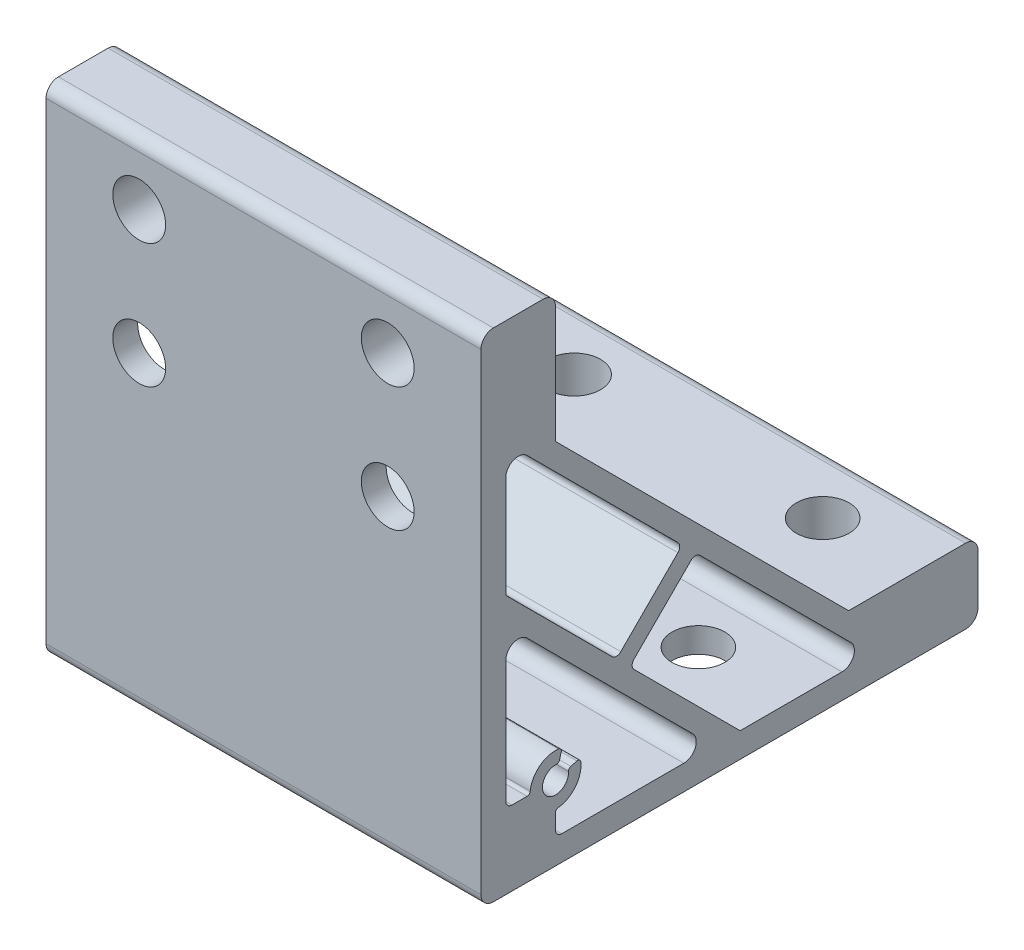
from build123d import *

# Parameters (mm, degrees)
BOSS_EXTRUDE1_DEPTH = 35
DIAMETERHOLE1_D     = 8.5
DIAMETERHOLE1_DEPTH = 12
DIAMETERHOLE2_D     = 8.5
DIAMETERHOLE2_DEPTH = 12.001
DIAMETERHOLE3_REACH = 120.427
SKETCH6_R           = 7
DIAMETERHOLE4_REACH = 120.427
SKETCH7_R           = 7
LPATTERN1_COUNT     = 2
LPATTERN1_PITCH     = 40


with BuildPart() as part:
    # Sketch1 → Boss-Extrude1 (new, symmetric)
    with BuildSketch(Plane(origin=(0, 0, 0), x_dir=(0, 0, -1), z_dir=(1, 0, 0))):
        with BuildLine():
            Line((2, 0), (78, 0))
            ThreePointArc((78, 0), (79.414213562, 0.585786438), (80, 2))
            Line((80, 2), (80, 10))
            ThreePointArc((80, 10), (79.414213562, 11.414213562), (78, 12))
            Line((78, 12), (59.176911935, 12))
            Line((59.176911935, 12), (12, 59.176911935))
            Line((12, 59.176911935), (12, 78))
            ThreePointArc((12, 78), (11.414213562, 79.414213562), (10, 80))
            Line((10, 80), (2, 80))
            ThreePointArc((2, 80), (0.585786438, 79.414213562), (0, 78))
            Line((0, 78), (0, 2))
            ThreePointArc((0, 2), (0.585786438, 0.585786438), (2, 0))
        make_face()
        with BuildLine():
            Line((7.414213562, 34.064213562), (34.064213562, 7.414213562))
            ThreePointArc((34.064213562, 7.414213562), (34.497759065, 5.234633135), (32.65, 4))
            Line((32.65, 4), (13, 4))
            ThreePointArc((13, 4), (12.292893219, 4.292893219), (12, 5))
            Line((12, 5), (12, 7.427254654))
            ThreePointArc((12, 7.427254654), (12.127727309, 7.761040579), (12.445652174, 7.924292192))
            ThreePointArc((12.445652174, 7.924292192), (15.214400117, 9.454880771), (16.069295651, 12.500832214))
            ThreePointArc((16.069295651, 12.500832214), (15.852577049, 12.854314019), (15.443630561, 12.922718028))
            Line((15.443630561, 12.922718028), (14.464530927, 12.660369072))
            ThreePointArc((14.464530927, 12.660369072), (14.187104489, 12.468068335), (14.095105748, 12.143289589))
            ThreePointArc((14.095105748, 12.143289589), (10.51507576, 10.51507576), (12.143289589, 14.095105748))
            ThreePointArc((12.143289589, 14.095105748), (12.468068335, 14.187104489), (12.660369072, 14.464530927))
            Line((12.660369072, 14.464530927), (12.922718028, 15.443630561))
            ThreePointArc((12.922718028, 15.443630561), (12.854314019, 15.852577049), (12.500832214, 16.069295651))
            ThreePointArc((12.500832214, 16.069295651), (9.454880771, 15.214400117), (7.924292192, 12.445652174))
            ThreePointArc((7.924292192, 12.445652174), (7.761040579, 12.127727309), (7.427254654, 12))
            Line((7.427254654, 12), (5, 12))
            ThreePointArc((5, 12), (4.292893219, 12.292893219), (4, 13))
            Line((4, 13), (4, 32.65))
            ThreePointArc((4, 32.65), (5.234633135, 34.497759065), (7.414213562, 34.064213562))
        make_face(mode=Mode.SUBTRACT)
        with BuildLine():
            Line((4, 58.105844123), (4, 41.721067812))
            Line((4, 41.721067812), (21.092766953, 24.628300859))
            ThreePointArc((21.092766953, 24.628300859), (21.799873734, 24.33540764), (22.506980515, 24.628300859))
            Line((22.506980515, 24.628300859), (31.699368671, 33.820689014))
            ThreePointArc((31.699368671, 33.820689014), (31.99226189, 34.527795796), (31.699368671, 35.234902577))
            Line((31.699368671, 35.234902577), (7.414213562, 59.520057685))
            ThreePointArc((7.414213562, 59.520057685), (5.234633135, 59.953603188), (4, 58.105844123))
        make_face(mode=Mode.SUBTRACT)
        with BuildLine():
            Line((33.820689014, 31.699368671), (24.628300859, 22.506980515))
            ThreePointArc((24.628300859, 22.506980515), (24.33540764, 21.799873734), (24.628300859, 21.092766953))
            Line((24.628300859, 21.092766953), (41.721067812, 4))
            Line((41.721067812, 4), (58.105844123, 4))
            ThreePointArc((58.105844123, 4), (59.953603188, 5.234633135), (59.520057685, 7.414213562))
            Line((59.520057685, 7.414213562), (35.234902577, 31.699368671))
            ThreePointArc((35.234902577, 31.699368671), (34.527795796, 31.99226189), (33.820689014, 31.699368671))
        make_face(mode=Mode.SUBTRACT)
    extrude(amount=BOSS_EXTRUDE1_DEPTH, both=True)

    # DiameterHole1
    with Locations(Plane.XY):
        with Locations((-20, 70), (-20, 50)):
            diameterhole1 = Hole(DIAMETERHOLE1_D / 2, depth=DIAMETERHOLE1_DEPTH)

    # DiameterHole2
    with Locations(Plane(origin=(0, 0, 0), x_dir=(-1, 0, 0), z_dir=(0, -1, 0))):
        with Locations((20, 70), (20, 50)):
            diameterhole2 = Hole(DIAMETERHOLE2_D / 2, depth=DIAMETERHOLE2_DEPTH)

    # DiameterHole3: up to this plane
    diameterhole3_end = Plane(origin=(35, 7.414213562, -59.520057685), z_dir=(0, -0.7071067811865515, 0.7071067811865437))
    # Sketch6 → DiameterHole3 (cut, up to the surface)
    with BuildSketch(Plane(origin=(0, 80, 0), x_dir=(1, 0, 0), z_dir=(0, 1, 0)), mode=Mode.PRIVATE) as diameterhole3_sk1:
        with Locations(Location((-20, 50, 0), (0, 0, 270))):
            Circle(SKETCH6_R)
    diameterhole3_tool1 = split(extrude(diameterhole3_sk1.sketch, amount=-DIAMETERHOLE3_REACH, mode=Mode.PRIVATE), bisect_by=diameterhole3_end, keep=Keep.BOTH, mode=Mode.PRIVATE)
    diameterhole3 = diameterhole3_tool1.solids().sort_by_distance((-20, 80, -50))[0]
    add(diameterhole3, mode=Mode.SUBTRACT)

    # DiameterHole4: up to this plane
    diameterhole4_end = Plane(origin=(35, 35.234902577, -31.699368671), z_dir=(0, -0.7071067811865511, 0.707106781186544))
    # Sketch7 → DiameterHole4 (cut, up to the surface)
    with BuildSketch(Plane(origin=(0, 0, -80), x_dir=(-1, 0, 0), z_dir=(0, 0, -1)), mode=Mode.PRIVATE) as diameterhole4_sk1:
        with Locations(Location((20, 50, 0), (0, 0, 270))):
            Circle(SKETCH7_R)
    diameterhole4_tool1 = split(extrude(diameterhole4_sk1.sketch, amount=-DIAMETERHOLE4_REACH, mode=Mode.PRIVATE), bisect_by=diameterhole4_end, keep=Keep.BOTH, mode=Mode.PRIVATE)
    diameterhole4 = diameterhole4_tool1.solids().sort_by_distance((-20, 50, -80))[0]
    add(diameterhole4, mode=Mode.SUBTRACT)

    # LPattern1: DiameterHole1, DiameterHole2, DiameterHole3, DiameterHole4 ×2
    with Locations(*[(i * LPATTERN1_PITCH, 0, 0) for i in range(1, LPATTERN1_COUNT)]):
        add(diameterhole1, mode=Mode.SUBTRACT)
        add(diameterhole2, mode=Mode.SUBTRACT)
        add(diameterhole3, mode=Mode.SUBTRACT)
        add(diameterhole4, mode=Mode.SUBTRACT)


solid = part.part
